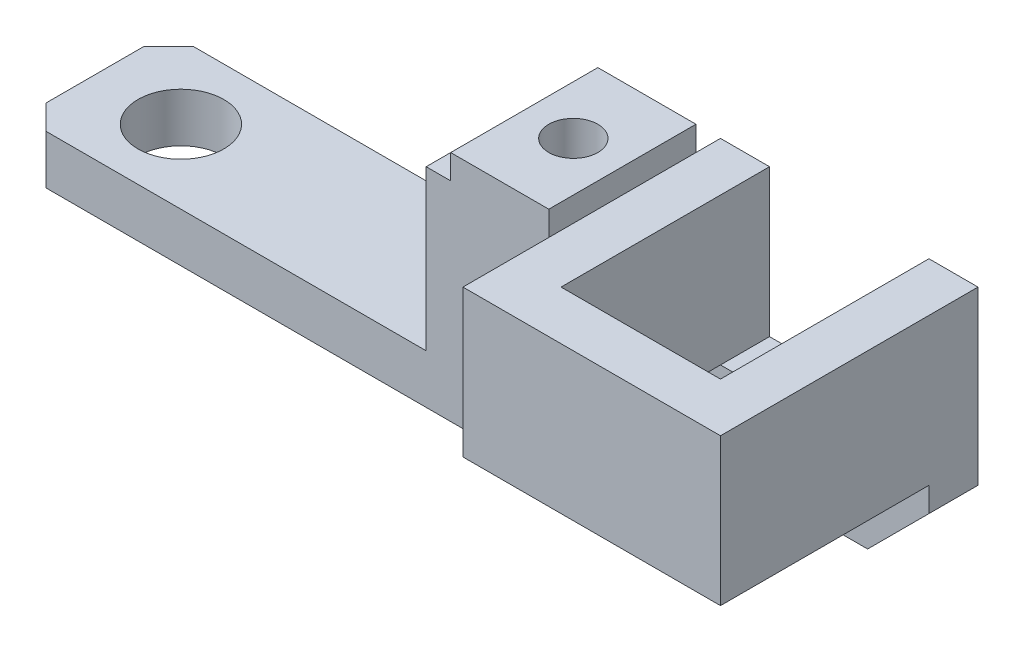
from build123d import *

# Parameters (mm, degrees)
SKETCH_1_W               = 33
SKETCH_1_H               = 12
EXTRUDE_1_DEPTH          = 4
SKETCH_1_3_W             = 12
SKETCH_1_3_H             = 12
EXTRUDE_2_DEPTH          = 19
SKETCH_2_W               = 2
SKETCH_2_H               = 12
CUT_EXTRUDE_1_DEPTH      = 2
SKETCH_3_W               = 21
SKETCH_3_H               = 21
EXTRUDE_3_DEPTH          = 19
CUT_EXTRUDE_2_DEPTH      = 58.028501646
SKETCH_5_W               = 13
SKETCH_5_H               = 13
CUT_EXTRUDE_3_DEPTH      = 56.102177815
SKETCH_6_W               = 13
SKETCH_6_H               = 4
CUT_EXTRUDE_4_DEPTH      = 12
SKETCH_7_W               = 21
SKETCH_7_H               = 7
CUT_EXTRUDE_5_DEPTH      = 17
CUT_EXTRUDE_6_DEPTH      = 54.853969213
CUT_EXTRUDE_6_DEPTH_BACK = 54.853969213
SKETCH_8_R               = 3.5
CUT_EXTRUDE_7_DEPTH      = 56.102177815
CUT_EXTRUDE_7_DEPTH_BACK = 56.102177815
SKETCH_9_R               = 2
CHAMFER_1_SIZE           = 2


with BuildPart() as part:
    # 草图1 → 凸台-拉伸1 (new body)
    with BuildSketch(Plane(origin=(0, 0, 0), x_dir=(1, 0, 0), z_dir=(0, 1, 0))):
        Rectangle(SKETCH_1_W, SKETCH_1_H)
    extrude(amount=EXTRUDE_1_DEPTH)

    # 草图1<3> → 凸台-拉伸2 (add)
    with BuildSketch(Plane(origin=(0, 0, 0), x_dir=(1, 0, 0), z_dir=(0, 1, 0))):
        with Locations((22.5, 0)):
            Rectangle(SKETCH_1_3_W, SKETCH_1_3_H)
    extrude(amount=EXTRUDE_2_DEPTH)

    # 草图2 → 切除-拉伸1 (cut)
    with BuildSketch(Plane(origin=(0, 19, 0), x_dir=(1, 0, 0), z_dir=(0, 1, 0))):
        with Locations((17.5, 0)):
            Rectangle(SKETCH_2_W, SKETCH_2_H)
        with Locations((27.5, 0)):
            Rectangle(SKETCH_2_W, SKETCH_2_H)
    extrude(amount=-CUT_EXTRUDE_1_DEPTH, mode=Mode.SUBTRACT)

    # 草图3 → 凸台-拉伸3 (add)
    with BuildSketch(Plane.XZ):
        with Locations((39, 4.5)):
            Rectangle(SKETCH_3_W, SKETCH_3_H)
    extrude(amount=-EXTRUDE_3_DEPTH)

    # 草图4 → 切除-拉伸2 (cut, through all)
    with BuildSketch(Plane.XY.offset(15)):
        Polygon((49.5, 5), (44.5, 0), (49.5, 0), align=None)
    extrude(amount=-CUT_EXTRUDE_2_DEPTH, mode=Mode.SUBTRACT)

    # 草图5 → 切除-拉伸3 (cut, through all)
    with BuildSketch(Plane(origin=(0, 19, 0), x_dir=(1, 0, 0), z_dir=(0, 1, 0))):
        with Locations((39, -4.5)):
            Rectangle(SKETCH_5_W, SKETCH_5_H)
    extrude(amount=-CUT_EXTRUDE_3_DEPTH, mode=Mode.SUBTRACT)

    # 草图6 → 切除-拉伸4 (cut)
    with BuildSketch(Plane(origin=(0, 19, 0), x_dir=(1, 0, 0), z_dir=(0, 1, 0))):
        with Locations((39, 4)):
            Rectangle(SKETCH_6_W, SKETCH_6_H)
    extrude(amount=-CUT_EXTRUDE_4_DEPTH, mode=Mode.SUBTRACT)

    # 草图7 → 切除-拉伸5 (cut)
    with BuildSketch(Plane.XY.offset(15)):
        with Locations((39, 3.5)):
            Rectangle(SKETCH_7_W, SKETCH_7_H)
    extrude(amount=-CUT_EXTRUDE_5_DEPTH, mode=Mode.SUBTRACT)

    # 草图8 → 切除-拉伸6 (cut, two sides: drawn at the far end of the back side and taken through both)
    with BuildSketch(Plane(origin=(0, 4, 0), x_dir=(1, 0, 0), z_dir=(0, 1, 0)).offset(-CUT_EXTRUDE_6_DEPTH_BACK)):
        with Locations(Location((-9.5, 0, 0), (0, 0, 270))):
            Circle(SKETCH_8_R)
    extrude(amount=CUT_EXTRUDE_6_DEPTH + CUT_EXTRUDE_6_DEPTH_BACK, mode=Mode.SUBTRACT)

    # 草图9 → 切除-拉伸7 (cut, two sides: drawn at the far end of the back side and taken through both)
    with BuildSketch(Plane(origin=(0, 19, 0), x_dir=(1, 0, 0), z_dir=(0, 1, 0)).offset(-CUT_EXTRUDE_7_DEPTH_BACK)):
        with Locations(Location((22.5, 0, 0), (0, 0, 270))):
            Circle(SKETCH_9_R)
    extrude(amount=CUT_EXTRUDE_7_DEPTH + CUT_EXTRUDE_7_DEPTH_BACK, mode=Mode.SUBTRACT)

    # 倒角1
    chamfer_1_edges = [part.edges().sort_by_distance(p)[0] for p in [
        (-16.5, 2, 6),
        (-16.5, 2, -6),
    ]]
    chamfer(chamfer_1_edges, length=CHAMFER_1_SIZE)


solid = part.part
